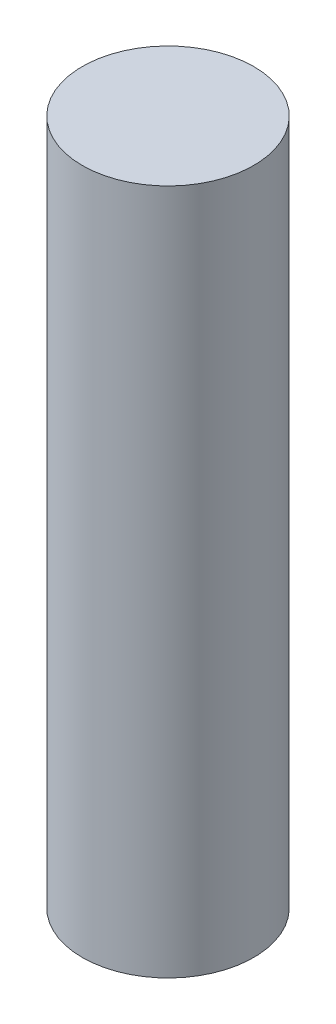
from build123d import *

# Parameters (mm, degrees)
SKETCH1_R           = 3.175
BOSS_EXTRUDE1_DEPTH = 25.4


with BuildPart() as part:
    # Sketch1 → Boss-Extrude1 (new body)
    with BuildSketch(Plane(origin=(0, 0, 0), x_dir=(1, 0, 0), z_dir=(0, 1, 0))):
        with Locations(Location((0, 0, 0), (0, 0, 270))):
            Circle(SKETCH1_R)
    extrude(amount=BOSS_EXTRUDE1_DEPTH)


solid = part.part
